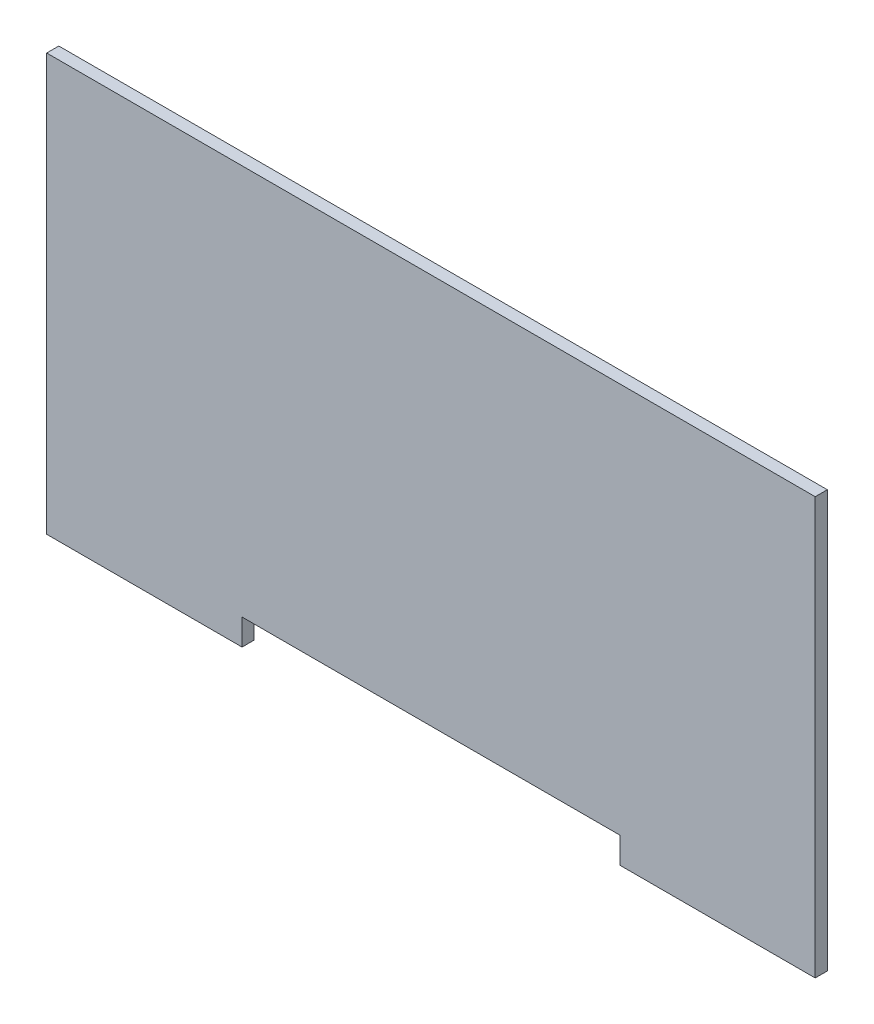
from build123d import *

# Parameters (mm, degrees)
SKETCH1_W           = 295
SKETCH1_H           = 150
SKETCH1_W_2         = 75
SKETCH1_H_2         = 10
BOSS_EXTRUDE1_DEPTH = 4.65


with BuildPart() as part:
    # Sketch1 → Boss-Extrude1 (new body)
    with BuildSketch(Plane.XY):
        Rectangle(SKETCH1_W, SKETCH1_H)
        with Locations((110, -80)):
            Rectangle(SKETCH1_W_2, SKETCH1_H_2)
        with Locations((-110, -80)):
            Rectangle(SKETCH1_W_2, SKETCH1_H_2)
    extrude(amount=BOSS_EXTRUDE1_DEPTH)


solid = part.part
